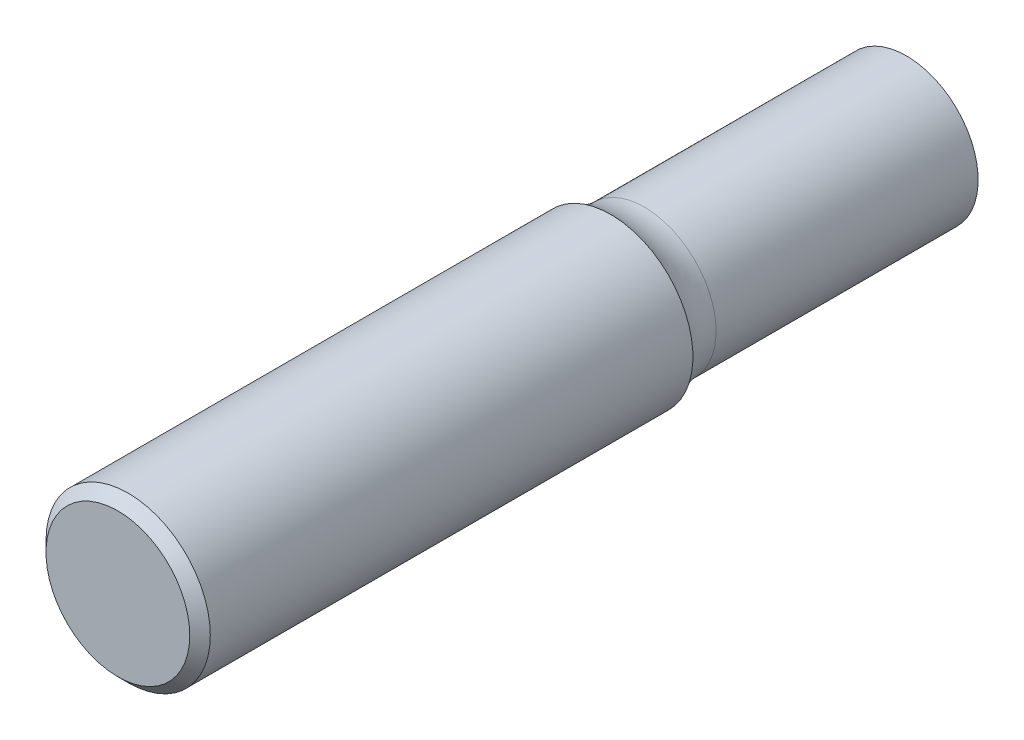
from build123d import *

# Parameters (mm, degrees)
CHAFL_N1_SIZE = 0.396875


with BuildPart() as part:
    # Croquis1 → Revolución1 (revolve)
    with BuildSketch(Plane(origin=(0, 0, 0), x_dir=(0, 0, -1), z_dir=(1, 0, 0)), mode=Mode.PRIVATE) as revoluci_n1_sk:
        with BuildLine():
            Line((-15.24, 0), (-15.24, 3.175))
            Line((-15.24, 3.175), (3.81, 3.175))
            ThreePointArc((3.81, 3.175), (4.429561326, 2.87256407), (5.111114845, 2.7686))
            Line((5.111114845, 2.7686), (15.24, 2.7686))
            Line((15.24, 2.7686), (15.24, 0))
            Line((15.24, 0), (-15.24, 0))
        make_face()
    revolve(revoluci_n1_sk.sketch.rotate(Axis((0, 0, -127), (0, 0, 1)), 90), axis=Axis((0, 0, -127), (0, 0, 1)))

    # Croquis4 → Cortar-Revolución1 (revolve, cut)
    with BuildSketch(Plane(origin=(0, 0, 0), x_dir=(0, 0, -1), z_dir=(1, 0, 0)), mode=Mode.PRIVATE) as cortar_revoluci_n1_sk:
        with BuildLine():
            ThreePointArc((15.24, 1.722711816), (14.861646983, 0.898025612), (14.732, 0))
            Line((14.732, 0), (15.24, 0))
            Line((15.24, 0), (15.24, 1.722711816))
        make_face()
        with BuildLine():
            ThreePointArc((14.732, 0), (14.861646983, 0.898025612), (15.24, 1.722711816))
            Line((15.24, 1.722711816), (15.24, 0))
            Line((15.24, 0), (14.732, 0))
        make_face()
    revolve(cortar_revoluci_n1_sk.sketch.rotate(Axis((0, 0, -15.24), (0, 0, 1)), 180), axis=Axis((0, 0, -15.24), (0, 0, 1)), mode=Mode.SUBTRACT)

    # Chaflán1
    chafl_n1_edges = [part.edges().sort_by_distance(p)[0] for p in [
        (3.175, 0, 15.24),
    ]]
    chamfer(chafl_n1_edges, length=CHAFL_N1_SIZE)


solid = part.part
